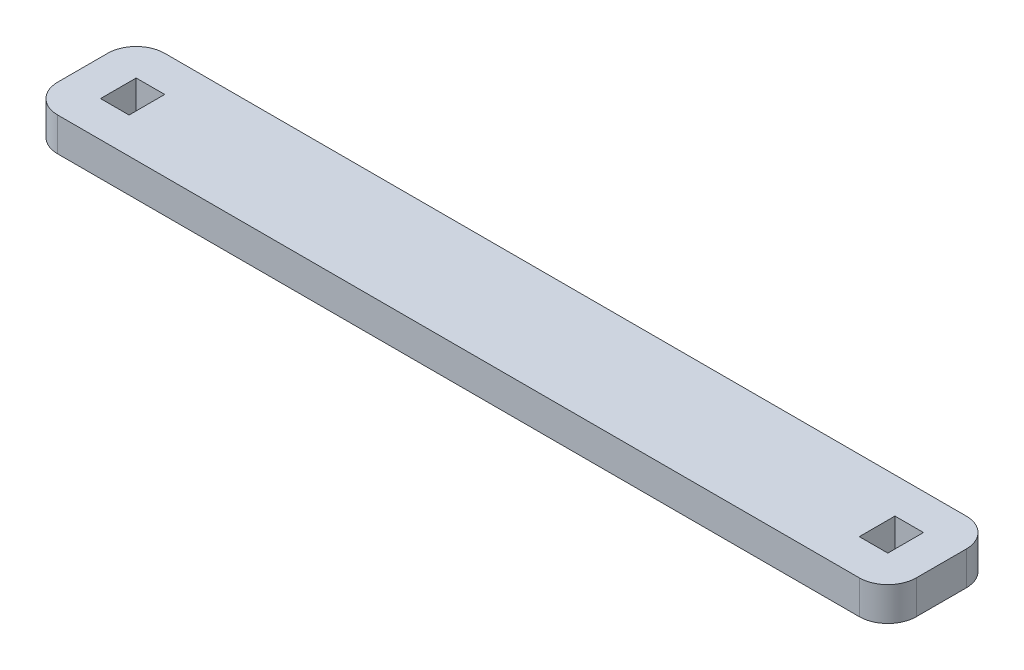
from build123d import *

# Parameters (mm, degrees)
SKETCH1_W           = 76.454
SKETCH1_H           = 9.525
SKETCH1_W_2         = 2.54
SKETCH1_H_2         = 3.175
BOSS_EXTRUDE1_DEPTH = 1.5
FILLET1_R           = 2.54


with BuildPart() as part:
    # Sketch1 → Boss-Extrude1 (new, symmetric)
    with BuildSketch(Plane(origin=(0, 0, 0), x_dir=(1, 0, 0), z_dir=(0, 1, 0))):
        Rectangle(SKETCH1_W, SKETCH1_H)
        with Locations((-33.782, 0)):
            Rectangle(SKETCH1_W_2, SKETCH1_H_2, mode=Mode.SUBTRACT)
        with Locations((33.782, 0)):
            Rectangle(SKETCH1_W_2, SKETCH1_H_2, mode=Mode.SUBTRACT)
    extrude(amount=BOSS_EXTRUDE1_DEPTH, both=True)

    # Fillet1
    fillet1_edges = [part.edges().sort_by_distance(p)[0] for p in [
        (-38.227, 0, -4.7625),
        (38.227, 0, -4.7625),
        (38.227, 0, 4.7625),
        (-38.227, 0, 4.7625),
    ]]
    fillet(fillet1_edges, radius=FILLET1_R)


solid = part.part
